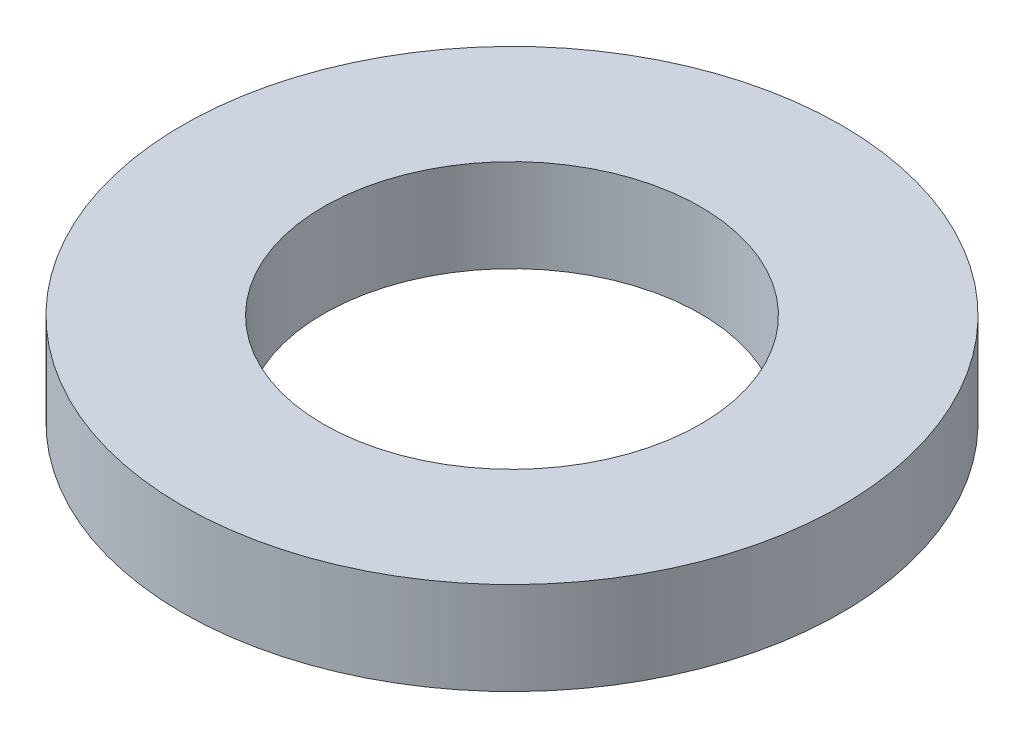
from build123d import *

# Parameters (mm, degrees)
SKETCH1_R           = 5.334
SKETCH1_R_2         = 3.05
BOSS_EXTRUDE1_DEPTH = 1.5


with BuildPart() as part:
    # Sketch1 → Boss-Extrude1 (new body)
    with BuildSketch(Plane(origin=(0, 0, 0), x_dir=(1, 0, 0), z_dir=(0, 1, 0))):
        with Locations(Location((0, 0, 0), (0, 0, 270))):
            Circle(SKETCH1_R)
        with Locations(Location((0, 0, 0), (0, 0, 270))):
            Circle(SKETCH1_R_2, mode=Mode.SUBTRACT)
    extrude(amount=BOSS_EXTRUDE1_DEPTH)


solid = part.part
